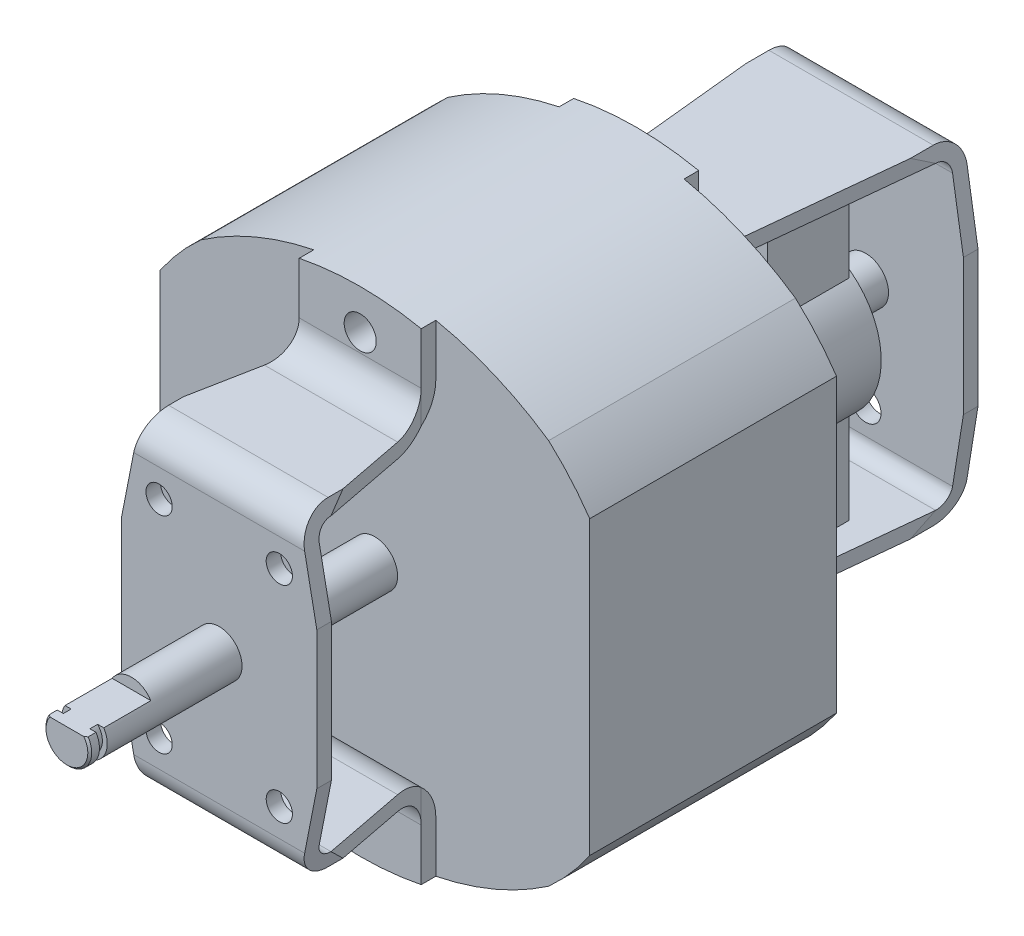
from build123d import *

# Parameters (mm, degrees)
MOTOR_CORE_DEPTH                   = 25.38
GEAR_END_PLATE_DEPTH               = 16
GEAR_END_PLATE_FILLET_R            = 3
GEAR_END_PLATE_CUT_DEPTH           = 59.513985508
SKETCH8_W                          = 12.55
SKETCH8_H                          = 9.5
GEAR_END_PLATE_TABS_DEPTH          = 1.5
GEAR_END_SIDE_CUT_DEPTH            = 64.300587675
GEAR_END_TAB_FILLET_R              = 3
GEAR_END_KLUDGE_FILLET_DEPTH       = 57.533596427
GEAR_END_KLUDGE_FILLET_DEPTH_BACK  = 57.533596427
GEAR_CADDY_SCREW_HOLES_REACH       = 55.659
SKETCH11_R                         = 1.35
ROTOR_END_PLATE_DEPTH              = 26.6
ROTOR_END_PLATE_FILLET_R           = 3
ROTOR_END_PLATE_CUT_DEPTH          = 59.519478808
ROTOR_END_PLATE_CUT_DEPTH_BACK     = 59.519478808
SKETCH15_W                         = 12.85
SKETCH15_H                         = 9
ROTOR_END_PLATE_TABS_DEPTH         = 1.5
ROTOR_END_SIDE_CT_DEPTH            = 64.637366382
ROTOR_END_SIDE_CT_DEPTH_BACK       = 64.637366382
ROTOR_END_TAB_FILLET_R             = 3
ROTOR_END_KLUDGE_FILLET_DEPTH      = 57.609032186
ROTOR_END_KLUDGE_FILLET_DEPTH_BACK = 57.609032186
MOTOR_LONG_SCREW_HOLES_DEPTH       = 54.659266674
MOTOR_LONG_SCREW_HOLES_DEPTH_BACK  = 54.659266674
SKETCH12_R                         = 1.65
MOTOR_SHAFT_DEPTH                  = 31.66
MOTOR_SHAFT_DEPTH_BACK             = 54.08
SKETCH1_R                          = 2.35
SKETCH3_R                          = 2.35
SKETCH3_R_2                        = 1.85
GROOVE_CUT_DEPTH                   = 1.8
SKETCH4_R                          = 2.35
GROOVE_FILL_DEPTH                  = 1
SHAFT_CHAMFER_SIZE                 = 0.2
MOTOR_GEAR_FLAT_DEPTH              = 6.64
ROTOR_END_PLATE_HOLES_REACH        = 92.347
SKETCH18_R                         = 1.58
MOTOR_START                        = -12
SKETCH20_R                         = 8
SKETCH20_R_2                       = 2.35
MOTOR_ROTOR_DEPTH                  = 12
MOTOR_START_2                      = -32.4
SKETCH21_W                         = 10.27446139
SKETCH21_H                         = 8.38731542
MOTOR_STATOR_BRUSHES_DEPTH         = 30.9
CUT_EXTRUDE1_DEPTH                 = 66.239166917


with BuildPart() as part:
    # motor core shape → motor core (new body)
    with BuildSketch(Plane.XY):
        with BuildLine():
            Line((-5.899788132, 26.05), (5.899788132, 26.05))
            ThreePointArc((5.899788132, 26.05), (15.050669715, 22.065523813), (22.1, 15))
            Line((22.1, 15), (22.1, -15))
            ThreePointArc((22.1, -15), (15.050669715, -22.065523813), (5.899788132, -26.05))
            Line((5.899788132, -26.05), (-5.899788132, -26.05))
            ThreePointArc((-5.899788132, -26.05), (-15.050669715, -22.065523813), (-22.1, -15))
            Line((-22.1, -15), (-22.1, 15))
            ThreePointArc((-22.1, 15), (-15.050669715, 22.065523813), (-5.899788132, 26.05))
        make_face()
    extrude(amount=MOTOR_CORE_DEPTH)

    # Sketch5 → gear end plate (add)
    with BuildSketch(Plane.XY.offset(25.38)):
        Polygon((8.2, 16.45), (10.04, 7.075), (10.04, -7.075), (8.2, -16.45), (-8.2, -16.45), (-10.04, -7.075), (-10.04, 7.075), (-8.2, 16.45), align=None)
    extrude(amount=GEAR_END_PLATE_DEPTH)

    # gear end plate fillet
    gear_end_plate_fillet_edges = [part.edges().sort_by_distance(p)[0] for p in [
        (0, 16.45, 41.38),
        (0, -16.45, 41.38),
    ]]
    fillet(gear_end_plate_fillet_edges, radius=GEAR_END_PLATE_FILLET_R)

    # Sketch7 → gear end plate cut (cut, through all)
    with BuildSketch(Plane.ZY.offset(10.04)):
        with BuildLine():
            Line((25.38, 14.95), (25.38, -14.95))
            Line((25.38, -14.95), (38.38, -14.95))
            ThreePointArc((38.38, -14.95), (39.440660172, -14.510660172), (39.88, -13.45))
            Line((39.88, -13.45), (39.88, -7.075))
            Line((39.88, -7.075), (39.88, 7.075))
            Line((39.88, 7.075), (39.88, 13.45))
            ThreePointArc((39.88, 13.45), (39.440660172, 14.510660172), (38.38, 14.95))
            Line((38.38, 14.95), (25.38, 14.95))
        make_face()
    extrude(amount=-GEAR_END_PLATE_CUT_DEPTH, mode=Mode.SUBTRACT)

    # Sketch8 → gear end plate tabs (add)
    with BuildSketch(Plane.XY.offset(25.38)):
        with Locations((0, 21.2)):
            Rectangle(SKETCH8_W, SKETCH8_H)
        with Locations((0, -21.2)):
            Rectangle(SKETCH8_W, SKETCH8_H)
    extrude(amount=GEAR_END_PLATE_TABS_DEPTH)

    # Sketch9 → gear end side cut (cut, through all)
    with BuildSketch(Plane.XZ.offset(16.45)):
        Polygon((-8.4944, 25.38), (-6.275, 25.38), (-6.275, 26.88), (-8.4944, 38.38), align=None)
        Polygon((6.275, 25.38), (8.4944, 25.38), (8.4944, 38.38), (6.275, 26.88), align=None)
    extrude(amount=-GEAR_END_SIDE_CUT_DEPTH, mode=Mode.SUBTRACT)

    # gear end tab fillet
    gear_end_tab_fillet_edges = [part.edges().sort_by_distance(p)[0] for p in [
        (0, -16.45, 26.88),
        (0, 16.45, 26.88),
    ]]
    fillet(gear_end_tab_fillet_edges, radius=GEAR_END_TAB_FILLET_R)

    # Sketch10 → gear end kludge fillet (cut, two sides: drawn at the far end of the back side and taken through both)
    with BuildSketch(Plane.ZY.offset(6.275).offset(-GEAR_END_KLUDGE_FILLET_DEPTH_BACK)):
        with BuildLine():
            Line((25.38, 19.45), (25.38, 14.95))
            Line((25.38, 14.95), (29.88, 14.95))
            ThreePointArc((29.88, 14.95), (26.698019485, 16.268019485), (25.38, 19.45))
        make_face()
        with BuildLine():
            Line((29.88, -14.95), (25.38, -14.95))
            Line((25.38, -14.95), (25.38, -19.45))
            ThreePointArc((25.38, -19.45), (26.698019485, -16.268019485), (29.88, -14.95))
        make_face()
    extrude(amount=GEAR_END_KLUDGE_FILLET_DEPTH + GEAR_END_KLUDGE_FILLET_DEPTH_BACK, mode=Mode.SUBTRACT)

    # Sketch11 → gear caddy screw holes (cut, up to next)
    with BuildSketch(Plane.XY.offset(41.38), mode=Mode.PRIVATE) as gear_caddy_screw_holes_sk1:
        with Locations((6.182497483, 10.598567114)):
            Circle(SKETCH11_R)
    gear_caddy_screw_holes_tool1 = extrude(gear_caddy_screw_holes_sk1.sketch, amount=-GEAR_CADDY_SCREW_HOLES_REACH, mode=Mode.PRIVATE) & part.part
    # Sketch11 → gear caddy screw holes (cut, up to next)
    with BuildSketch(Plane.XY.offset(41.38), mode=Mode.PRIVATE) as gear_caddy_screw_holes_sk2:
        with Locations(Location((-6.182497483, 10.598567114, 0), (0, 0, 180))):
            Circle(SKETCH11_R)
    gear_caddy_screw_holes_tool2 = extrude(gear_caddy_screw_holes_sk2.sketch, amount=-GEAR_CADDY_SCREW_HOLES_REACH, mode=Mode.PRIVATE) & part.part
    # Sketch11 → gear caddy screw holes (cut, up to next)
    with BuildSketch(Plane.XY.offset(41.38), mode=Mode.PRIVATE) as gear_caddy_screw_holes_sk3:
        with Locations((-6.182497483, -10.598567114)):
            Circle(SKETCH11_R)
    gear_caddy_screw_holes_tool3 = extrude(gear_caddy_screw_holes_sk3.sketch, amount=-GEAR_CADDY_SCREW_HOLES_REACH, mode=Mode.PRIVATE) & part.part
    # Sketch11 → gear caddy screw holes (cut, up to next)
    with BuildSketch(Plane.XY.offset(41.38), mode=Mode.PRIVATE) as gear_caddy_screw_holes_sk4:
        with Locations(Location((6.182497483, -10.598567114, 0), (0, 0, 180))):
            Circle(SKETCH11_R)
    gear_caddy_screw_holes_tool4 = extrude(gear_caddy_screw_holes_sk4.sketch, amount=-GEAR_CADDY_SCREW_HOLES_REACH, mode=Mode.PRIVATE) & part.part
    add(gear_caddy_screw_holes_tool1.solids().sort_by_distance((6.182497, 10.598567, 41.38))[0], mode=Mode.SUBTRACT)
    add(gear_caddy_screw_holes_tool2.solids().sort_by_distance((-6.182497, 10.598567, 41.38))[0], mode=Mode.SUBTRACT)
    add(gear_caddy_screw_holes_tool3.solids().sort_by_distance((-6.182497, -10.598567, 41.38))[0], mode=Mode.SUBTRACT)
    add(gear_caddy_screw_holes_tool4.solids().sort_by_distance((6.182497, -10.598567, 41.38))[0], mode=Mode.SUBTRACT)

    # Sketch13 → rotor end plate (add)
    with BuildSketch(Plane(origin=(0, 0, 0), x_dir=(-1, 0, 0), z_dir=(0, 0, -1))):
        Polygon((-8.45, 16.95), (8.45, 16.95), (10.05, 7), (10.05, -7), (8.45, -16.95), (-8.45, -16.95), (-10.05, -7), (-10.05, 7), align=None)
    extrude(amount=ROTOR_END_PLATE_DEPTH)

    # rotor end plate fillet
    rotor_end_plate_fillet_edges = [part.edges().sort_by_distance(p)[0] for p in [
        (0, 16.95, -26.6),
        (0, -16.95, -26.6),
    ]]
    fillet(rotor_end_plate_fillet_edges, radius=ROTOR_END_PLATE_FILLET_R)

    # Sketch14 → rotor end plate cut (cut, two sides: drawn at the far end of the back side and taken through both)
    with BuildSketch(Plane(origin=(10.05, 0, 0), x_dir=(0, 0, -1), z_dir=(1, 0, 0)).offset(-ROTOR_END_PLATE_CUT_DEPTH_BACK)):
        with BuildLine():
            Line((0, -15.45), (0, 15.45))
            Line((0, 15.45), (23.6, 15.45))
            ThreePointArc((23.6, 15.45), (24.660660172, 15.010660172), (25.1, 13.95))
            Line((25.1, 13.95), (25.1, 7))
            Line((25.1, 7), (25.1, -7))
            Line((25.1, -7), (25.1, -13.95))
            ThreePointArc((25.1, -13.95), (24.660660172, -15.010660172), (23.6, -15.45))
            Line((23.6, -15.45), (0, -15.45))
        make_face()
    extrude(amount=ROTOR_END_PLATE_CUT_DEPTH + ROTOR_END_PLATE_CUT_DEPTH_BACK, mode=Mode.SUBTRACT)

    # Sketch15 → rotor end plate tabs (add)
    with BuildSketch(Plane(origin=(0, 0, 0), x_dir=(-1, 0, 0), z_dir=(0, 0, -1))):
        with Locations((0, 21.45)):
            Rectangle(SKETCH15_W, SKETCH15_H)
        with Locations((0, -21.45)):
            Rectangle(SKETCH15_W, SKETCH15_H)
    extrude(amount=ROTOR_END_PLATE_TABS_DEPTH)

    # Sketch16 → rotor end side ct (cut, two sides: drawn at the far end of the back side and taken through both)
    with BuildSketch(Plane.XZ.offset(16.95).offset(-ROTOR_END_SIDE_CT_DEPTH_BACK)):
        Polygon((-8.69120603, -23.6), (-8.69120603, 0), (-6.425, 0), (-6.425, -1.5), align=None)
        Polygon((6.425, -1.5), (6.425, 0), (8.69120603, 0), (8.69120603, -23.6), align=None)
    extrude(amount=ROTOR_END_SIDE_CT_DEPTH + ROTOR_END_SIDE_CT_DEPTH_BACK, mode=Mode.SUBTRACT)

    # rotor end tab fillet
    rotor_end_tab_fillet_edges = [part.edges().sort_by_distance(p)[0] for p in [
        (0, -16.95, -1.5),
        (0, 16.95, -1.5),
    ]]
    fillet(rotor_end_tab_fillet_edges, radius=ROTOR_END_TAB_FILLET_R)

    # Sketch17 → rotor end kludge fillet (cut, two sides: drawn at the far end of the back side and taken through both)
    with BuildSketch(Plane.ZY.offset(6.425).offset(-ROTOR_END_KLUDGE_FILLET_DEPTH_BACK)):
        with BuildLine():
            Line((0, 19.95), (0, 15.45))
            Line((0, 15.45), (-4.5, 15.45))
            ThreePointArc((-4.5, 15.45), (-1.318019485, 16.768019485), (0, 19.95))
        make_face()
        with BuildLine():
            Line((0, -19.95), (0, -15.45))
            Line((0, -15.45), (-4.5, -15.45))
            ThreePointArc((-4.5, -15.45), (-1.318019485, -16.768019485), (0, -19.95))
        make_face()
    extrude(amount=ROTOR_END_KLUDGE_FILLET_DEPTH + ROTOR_END_KLUDGE_FILLET_DEPTH_BACK, mode=Mode.SUBTRACT)

    # Sketch12 → motor long screw holes (cut, two sides: drawn at the far end of the back side and taken through both)
    with BuildSketch(Plane(origin=(0, 0, 0), x_dir=(-1, 0, 0), z_dir=(0, 0, -1)).offset(-MOTOR_LONG_SCREW_HOLES_DEPTH_BACK)):
        with Locations(Location((0, 21.3, 0), (0, 0, 305.096801228))):
            Circle(SKETCH12_R)
        with Locations((0, -21.3)):
            Circle(SKETCH12_R)
    extrude(amount=MOTOR_LONG_SCREW_HOLES_DEPTH + MOTOR_LONG_SCREW_HOLES_DEPTH_BACK, mode=Mode.SUBTRACT)

    # Sketch1 → motor shaft (add, two sides: drawn at the far end of the back side and taken through both)
    with BuildSketch(Plane.XY.offset(25.38).offset(-MOTOR_SHAFT_DEPTH_BACK)):
        Circle(SKETCH1_R)
    extrude(amount=MOTOR_SHAFT_DEPTH + MOTOR_SHAFT_DEPTH_BACK)

    # Sketch3 → groove cut (cut)
    with BuildSketch(Plane.XY.offset(57.04)):
        with Locations(Location((0, 0, 0), (0, 0, 180))):
            Circle(SKETCH3_R)
        Circle(SKETCH3_R_2, mode=Mode.SUBTRACT)
    extrude(amount=-GROOVE_CUT_DEPTH, mode=Mode.SUBTRACT)

    # Sketch4 → groove fill (add)
    with BuildSketch(Plane.XY.offset(57.04)):
        with Locations(Location((0, 0, 0), (0, 0, 180))):
            Circle(SKETCH4_R)
    extrude(amount=-GROOVE_FILL_DEPTH)

    # shaft chamfer
    shaft_chamfer_edges = [part.edges().sort_by_distance(p)[0] for p in [
        (2.35, 0, 57.04),
    ]]
    chamfer(shaft_chamfer_edges, length=SHAFT_CHAMFER_SIZE)

    # Sketch2 → motor gear flat (cut)
    with BuildSketch(Plane.XY.offset(57.04)):
        with BuildLine():
            Line((-1.989974874, 1.25), (1.989974874, 1.25))
            ThreePointArc((1.989974874, 1.25), (0, 2.35), (-1.989974874, 1.25))
        make_face()
    extrude(amount=-MOTOR_GEAR_FLAT_DEPTH, mode=Mode.SUBTRACT)

    # Sketch18 → rotor end plate holes (cut, up to next)
    with BuildSketch(Plane(origin=(0, 0, -26.6), x_dir=(-1, 0, 0), z_dir=(0, 0, -1)), mode=Mode.PRIVATE) as rotor_end_plate_holes_sk1:
        with Locations((0, 11.12)):
            Circle(SKETCH18_R)
    rotor_end_plate_holes_tool1 = extrude(rotor_end_plate_holes_sk1.sketch, amount=-ROTOR_END_PLATE_HOLES_REACH, mode=Mode.PRIVATE) & part.part
    # Sketch18 → rotor end plate holes (cut, up to next)
    with BuildSketch(Plane(origin=(0, 0, -26.6), x_dir=(-1, 0, 0), z_dir=(0, 0, -1)), mode=Mode.PRIVATE) as rotor_end_plate_holes_sk2:
        with Locations(Location((0, -11.12, 0), (0, 0, 180))):
            Circle(SKETCH18_R)
    rotor_end_plate_holes_tool2 = extrude(rotor_end_plate_holes_sk2.sketch, amount=-ROTOR_END_PLATE_HOLES_REACH, mode=Mode.PRIVATE) & part.part
    add(rotor_end_plate_holes_tool1.solids().sort_by_distance((0, 11.12, -26.6))[0], mode=Mode.SUBTRACT)
    add(rotor_end_plate_holes_tool2.solids().sort_by_distance((0, -11.12, -26.6))[0], mode=Mode.SUBTRACT)

    # Sketch20 → motor rotor (add)
    with BuildSketch(Plane(origin=(0, 0, -18.7), x_dir=(-1, 0, 0), z_dir=(0, 0, -1)).offset(MOTOR_START)):
        Circle(SKETCH20_R)
        Circle(SKETCH20_R_2, mode=Mode.SUBTRACT)
    extrude(amount=MOTOR_ROTOR_DEPTH)

    # Sketch21 → motor stator,brushes (add)
    with BuildSketch(Plane(origin=(0, 16.95, 0), x_dir=(-1, 0, 0), z_dir=(0, 1, 0)).offset(MOTOR_START_2)):
        with Locations((0, -14.052982329)):
            Rectangle(SKETCH21_W, SKETCH21_H)
    extrude(amount=MOTOR_STATOR_BRUSHES_DEPTH)

    # Sketch22 → Cut-Extrude1 (cut, through all)
    with BuildSketch(Plane.XY.offset(26.88)):
        with BuildLine():
            Line((-5.899788132, 26.05), (6.425, 25.925458048))
            ThreePointArc((6.425, 25.925458048), (12.52564942, 23.590635994), (17.877135091, 19.844849229))
            ThreePointArc((17.877135091, 19.844849229), (0, 25.385679038), (-17.877135091, 19.844849229))
            ThreePointArc((-17.877135091, 19.844849229), (-12.286638821, 23.715996848), (-5.899788132, 26.05))
        make_face()
        with BuildLine():
            Line((-5.899788132, -26.05), (6.425, -25.925458048))
            ThreePointArc((6.425, -25.925458048), (12.52564942, -23.590635994), (17.877135091, -19.844849229))
            ThreePointArc((17.877135091, -19.844849229), (0, -25.385679038), (-17.877135091, -19.844849229))
            ThreePointArc((-17.877135091, -19.844849229), (-12.286638821, -23.715996848), (-5.899788132, -26.05))
        make_face()
    extrude(amount=-CUT_EXTRUDE1_DEPTH, mode=Mode.SUBTRACT)


with BuildPart() as cut_extrude1_kept_piece:
    # of the separate pieces the step leaves, the one the design keeps (cut_extrude1_pieces_kept)
    add(part.part.solids().sort_by_distance((1.989974874, 1.25, 56.84))[0])


solid = cut_extrude1_kept_piece.part
